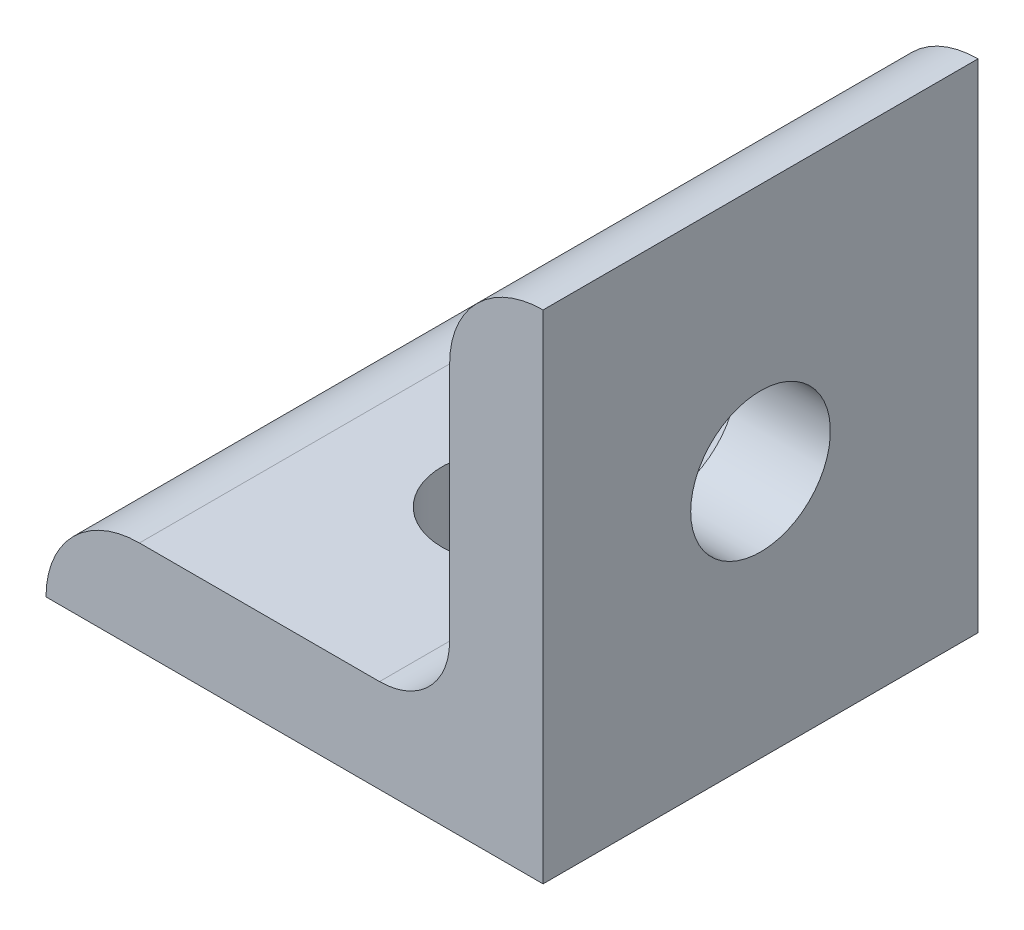
from build123d import *

# Parameters (mm, degrees)
EXTRUDE1_DEPTH     = 11.1125
SKETCH2_R          = 3.5687
CUT_EXTRUDE1_DEPTH = 35.554739636
SKETCH3_R          = 3.5687
CUT_EXTRUDE2_DEPTH = 35.554739636


with BuildPart() as part:
    # Sketch1 → Extrude1 (new, symmetric)
    with BuildSketch(Plane.XY):
        with BuildLine():
            Line((0, 0), (0, 25.4))
            ThreePointArc((0, 25.4), (-3.376576302, 24.001376302), (-4.7752, 20.6248))
            Line((-4.7752, 20.6248), (-4.7752, 8.3566))
            ThreePointArc((-4.7752, 8.3566), (-5.824167774, 5.824167774), (-8.3566, 4.7752))
            Line((-8.3566, 4.7752), (-20.6248, 4.7752))
            ThreePointArc((-20.6248, 4.7752), (-24.001376302, 3.376576302), (-25.4, 0))
            Line((-25.4, 0), (0, 0))
        make_face()
    extrude(amount=EXTRUDE1_DEPTH, both=True)

    # Sketch2 → Cut-Extrude1 (cut, through all)
    with BuildSketch(Plane(origin=(0, 4.7752, 0), x_dir=(1, 0, 0), z_dir=(0, 1, 0))):
        with Locations(Location((-12.7, 0, 0), (0, 0, 270))):
            Circle(SKETCH2_R)
    extrude(amount=-CUT_EXTRUDE1_DEPTH, mode=Mode.SUBTRACT)

    # Sketch3 → Cut-Extrude2 (cut, through all)
    with BuildSketch(Plane.ZY.offset(4.7752)):
        with Locations((0, 12.7)):
            Circle(SKETCH3_R)
    extrude(amount=-CUT_EXTRUDE2_DEPTH, mode=Mode.SUBTRACT)


solid = part.part
